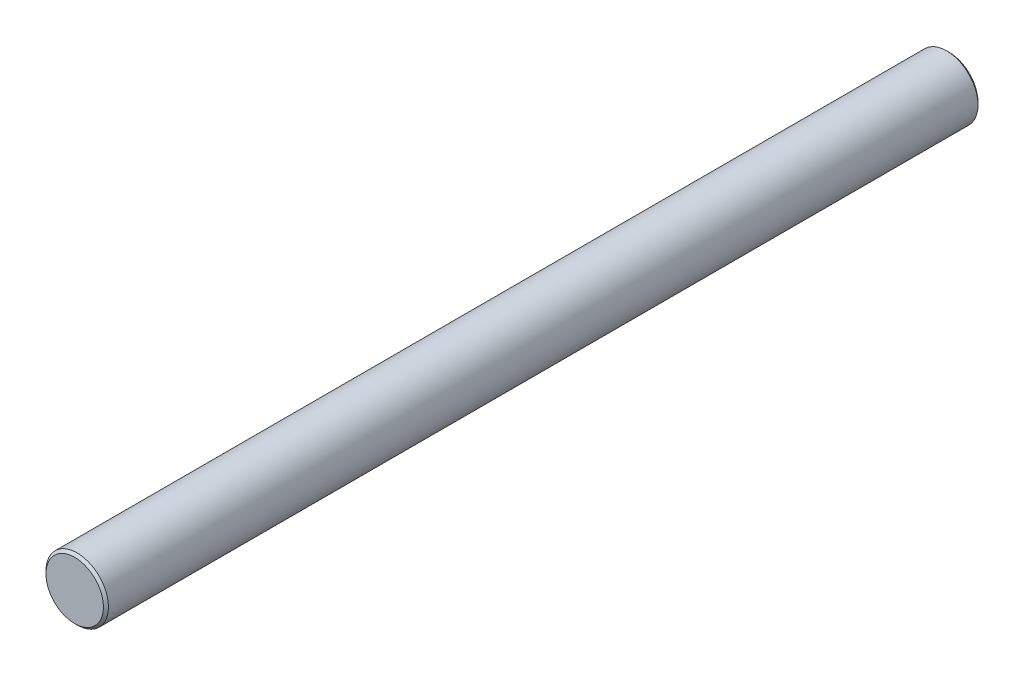
from build123d import *

# Parameters (mm, degrees)
SKIZZE1_R                       = 5
AUFSATZ_LINEAR_AUSTRAGEN1_DEPTH = 140
FASE1_SIZE                      = 0.4


with BuildPart() as part:
    # Skizze1 → Aufsatz-Linear austragen1 (new body)
    with BuildSketch(Plane.XY):
        Circle(SKIZZE1_R)
    extrude(amount=AUFSATZ_LINEAR_AUSTRAGEN1_DEPTH)

    # Fase1
    fase1_edges = [part.edges().sort_by_distance(p)[0] for p in [
        (-5, 0, 0),
        (-5, 0, 140),
    ]]
    chamfer(fase1_edges, length=FASE1_SIZE)


solid = part.part
